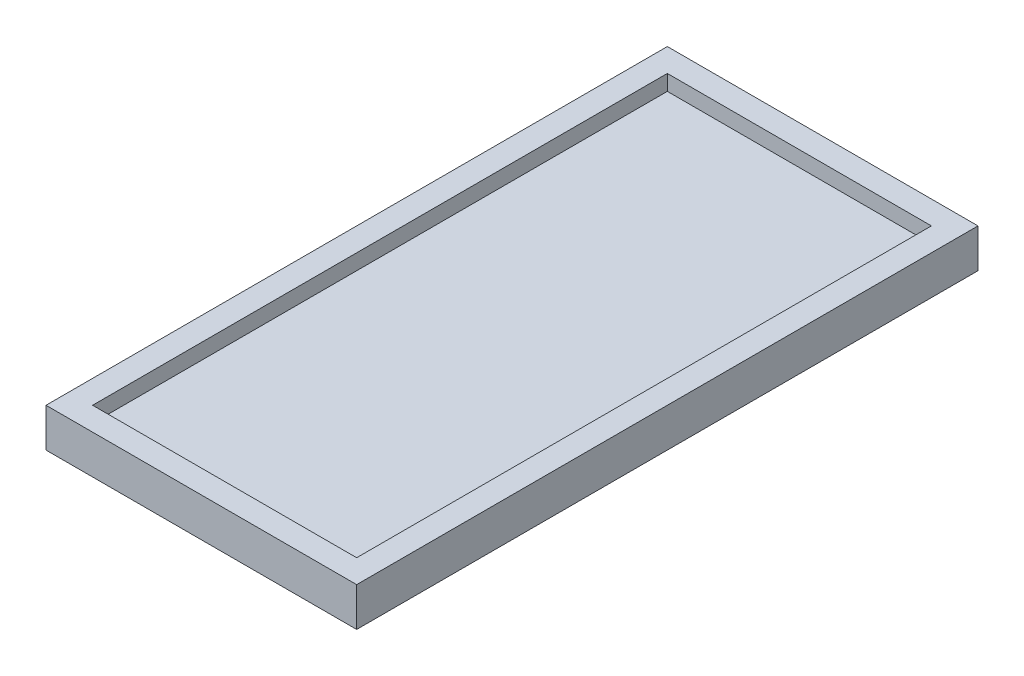
from build123d import *

# Parameters (mm, degrees)
SKETCH1_W           = 40
SKETCH1_H           = 80
BOSS_EXTRUDE1_DEPTH = 3
SKETCH2_W           = 40
SKETCH2_H           = 80
SKETCH2_W_2         = 34
SKETCH2_H_2         = 74
BOSS_EXTRUDE2_DEPTH = 2


with BuildPart() as part:
    # Sketch1 → Boss-Extrude1 (new body)
    with BuildSketch(Plane(origin=(0, 0, 0), x_dir=(1, 0, 0), z_dir=(0, 1, 0))):
        Rectangle(SKETCH1_W, SKETCH1_H)
    extrude(amount=BOSS_EXTRUDE1_DEPTH)

    # Sketch2 → Boss-Extrude2 (add)
    with BuildSketch(Plane(origin=(0, 3, 0), x_dir=(1, 0, 0), z_dir=(0, 1, 0))):
        Rectangle(SKETCH2_W, SKETCH2_H)
        Rectangle(SKETCH2_W_2, SKETCH2_H_2, mode=Mode.SUBTRACT)
    extrude(amount=BOSS_EXTRUDE2_DEPTH)


solid = part.part
